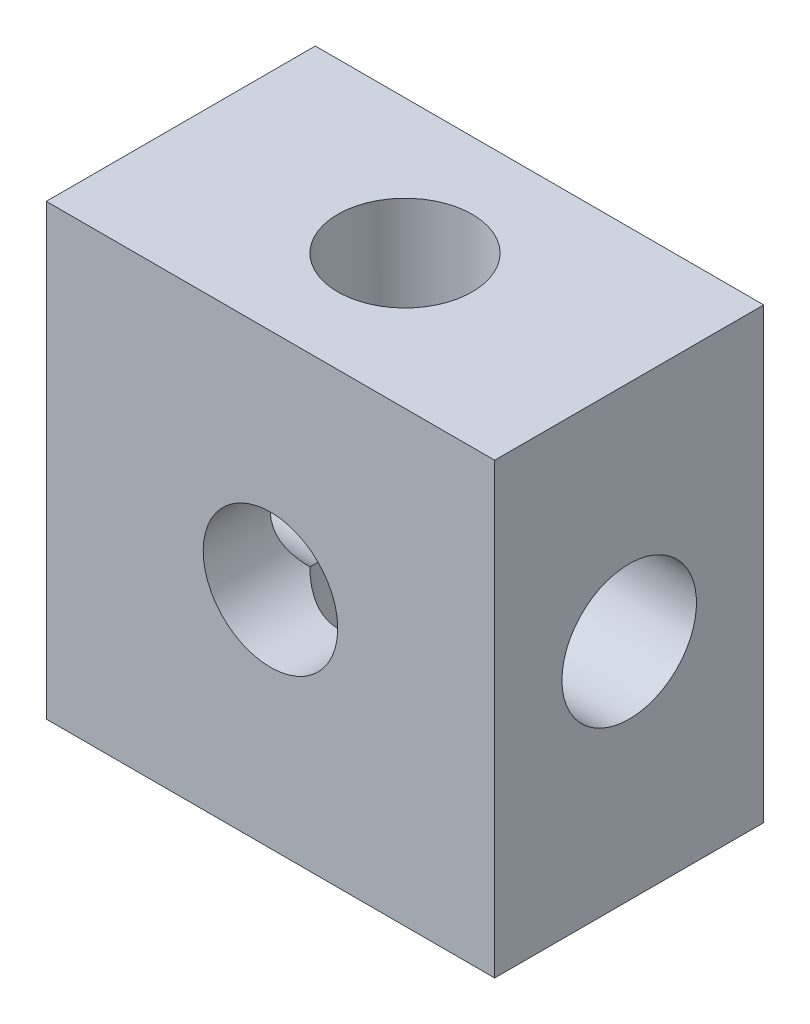
from build123d import *

# Parameters (mm, degrees)
SKETCH_1_W          = 10
SKETCH_1_H          = 10
EXTRUDE_1_DEPTH     = 6
SKETCH_2_R          = 1.5
CUT_EXTRUDE_1_DEPTH = 16.362291496
SKETCH_3_R          = 1.5
CUT_EXTRUDE_2_DEPTH = 16.362291496
SKETCH_4_R          = 1.5
CUT_EXTRUDE_3_DEPTH = 16.362291496


with BuildPart() as part:
    # 草图1 → 凸台-拉伸1 (new body)
    with BuildSketch(Plane.XY):
        with Locations((5, 5)):
            Rectangle(SKETCH_1_W, SKETCH_1_H)
    extrude(amount=EXTRUDE_1_DEPTH)

    # 草图2 → 切除-拉伸1 (cut, through all)
    with BuildSketch(Plane(origin=(0, 0, 0), x_dir=(-1, 0, 0), z_dir=(0, 0, -1))):
        with Locations((-5, 5)):
            Circle(SKETCH_2_R)
    extrude(amount=-CUT_EXTRUDE_1_DEPTH, mode=Mode.SUBTRACT)

    # 草图3 → 切除-拉伸2 (cut, through all)
    with BuildSketch(Plane(origin=(0, 10, 0), x_dir=(1, 0, 0), z_dir=(0, 1, 0))):
        with Locations(Location((5, -3, 0), (0, 0, 180))):
            Circle(SKETCH_3_R)
    extrude(amount=-CUT_EXTRUDE_2_DEPTH, mode=Mode.SUBTRACT)

    # 草图4 → 切除-拉伸3 (cut, through all)
    with BuildSketch(Plane.ZY):
        with Locations((3, 5)):
            Circle(SKETCH_4_R)
    extrude(amount=-CUT_EXTRUDE_3_DEPTH, mode=Mode.SUBTRACT)


solid = part.part
